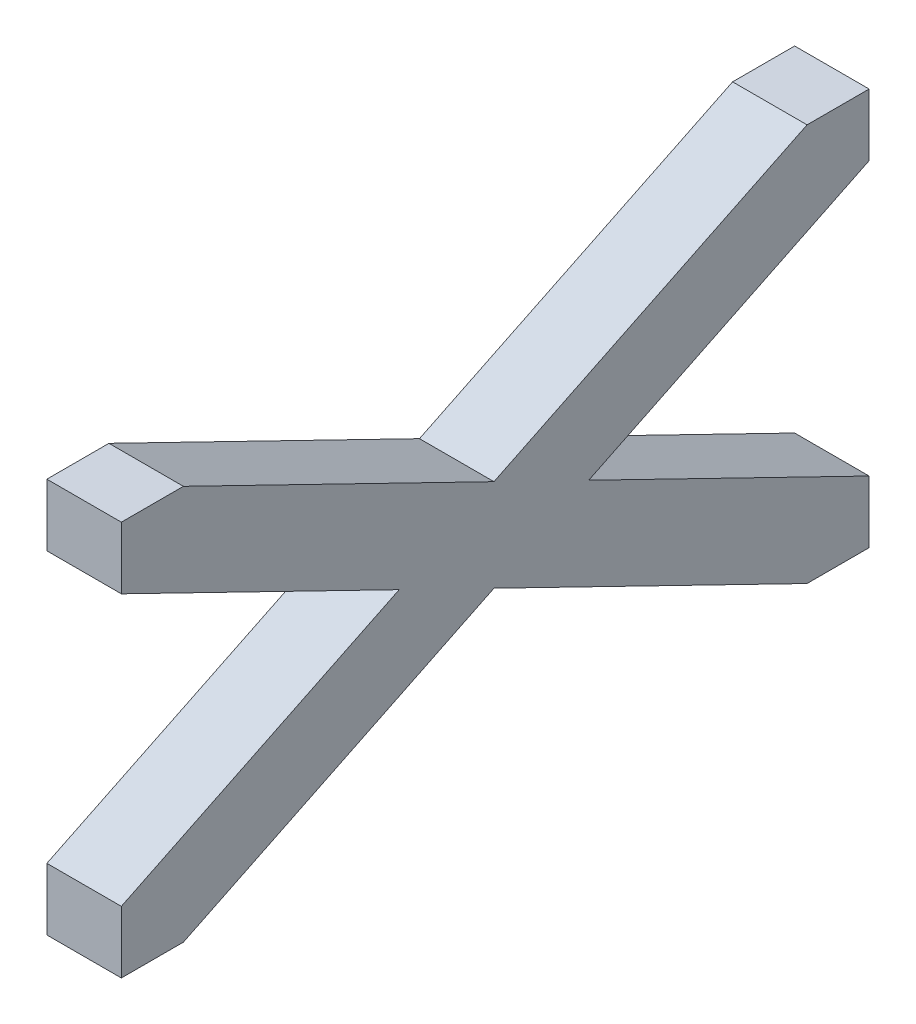
from build123d import *

# Parameters (mm, degrees)
BOSS_EXTRUDE1_DEPTH = 7.62


with BuildPart() as part:
    # Sketch1 → Boss-Extrude1 (new body)
    with BuildSketch(Plane(origin=(-22.749553377, 0, 0), x_dir=(0, 0, -1), z_dir=(1, 0, 0))):
        Polygon((-112.227241806, 51.836669294), (-105.877241806, 51.836669294), (-74.104597168, 36.364189717), (-42.072441806, 51.963044496), (-35.722441806, 51.963044496), (-35.722441806, 45.613044496), (-64.409753583, 31.643044496), (-35.722441806, 17.673044496), (-35.722441806, 11.323044496), (-42.072441806, 11.323044496), (-74.104597168, 26.921899275), (-105.877241806, 11.449419699), (-112.227241806, 11.449419699), (-112.227241806, 17.799419699), (-83.799440754, 31.643044496), (-112.227241806, 45.486669294), align=None)
    extrude(amount=-BOSS_EXTRUDE1_DEPTH)


solid = part.part
